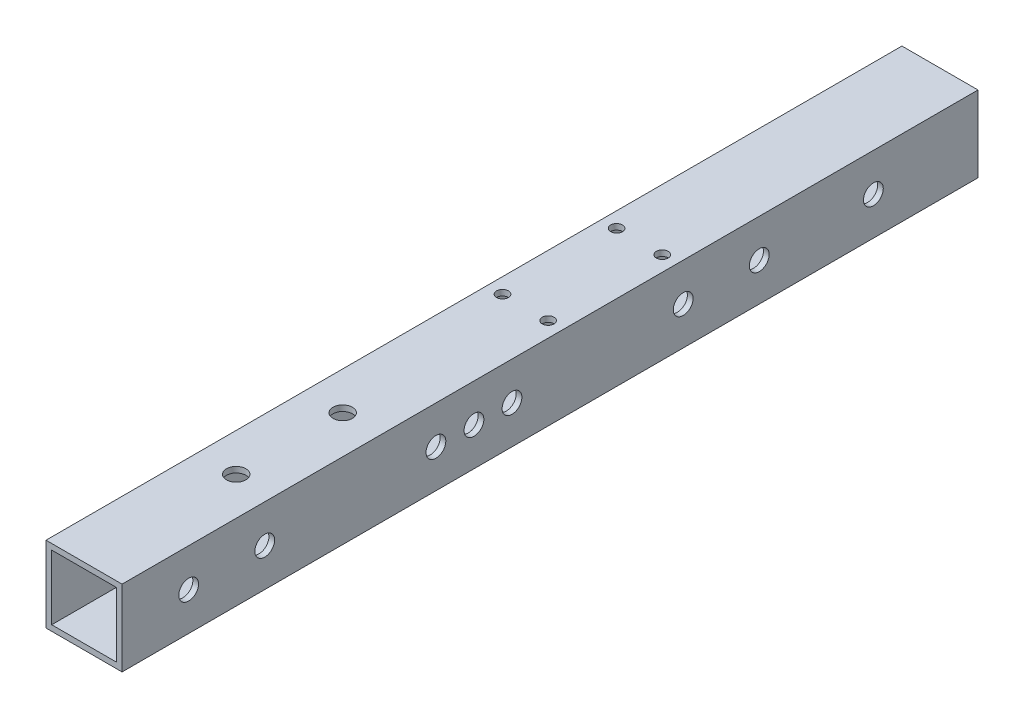
from build123d import *

# Parameters (mm, degrees)
SKETCH_1_W          = 20
SKETCH_1_H          = 20
SKETCH_1_W_2        = 17
SKETCH_1_H_2        = 17
EXTRUDE_1_DEPTH     = 112.5
SKETCH_2_R          = 2.55
CUT_EXTRUDE_1_DEPTH = 115.70069747
SKETCH_3_R          = 2.6
CUT_EXTRUDE_2_DEPTH = 115.70069747
SKETCH_4_R          = 1.55
CUT_EXTRUDE_3_DEPTH = 115.70069747


with BuildPart() as part:
    # 草图1 → 凸台-拉伸1 (new, symmetric)
    with BuildSketch(Plane.XY):
        Rectangle(SKETCH_1_W, SKETCH_1_H)
        Rectangle(SKETCH_1_W_2, SKETCH_1_H_2, mode=Mode.SUBTRACT)
    extrude(amount=EXTRUDE_1_DEPTH, both=True)

    # 草图2 → 切除-拉伸1 (cut, through all)
    with BuildSketch(Plane(origin=(0, 10, 0), x_dir=(1, 0, 0), z_dir=(0, 1, 0))):
        with Locations(Location((0, -72.5, 0), (0, 0, 270))):
            Circle(SKETCH_2_R)
        with Locations(Location((0, -44.5, 0), (0, 0, 270))):
            Circle(SKETCH_2_R)
    extrude(amount=-CUT_EXTRUDE_1_DEPTH, mode=Mode.SUBTRACT)

    # 草图3 → 切除-拉伸2 (cut, through all)
    with BuildSketch(Plane(origin=(10, 0, 0), x_dir=(0, 0, -1), z_dir=(1, 0, 0))):
        with Locations(Location((85, 0, 0), (0, 0, 90))):
            Circle(SKETCH_3_R)
        with Locations(Location((55, 0, 0), (0, 0, 90))):
            Circle(SKETCH_3_R)
        with Locations(Location((35, 0, 0), (0, 0, 90))):
            Circle(SKETCH_3_R)
        with Locations(Location((-10, 0, 0), (0, 0, 90))):
            Circle(SKETCH_3_R)
        with Locations(Location((-20, 0, 0), (0, 0, 90))):
            Circle(SKETCH_3_R)
        with Locations(Location((-30, 0, 0), (0, 0, 90))):
            Circle(SKETCH_3_R)
        with Locations(Location((-75, 0, 0), (0, 0, 90))):
            Circle(SKETCH_3_R)
        with Locations(Location((-95, 0, 0), (0, 0, 90))):
            Circle(SKETCH_3_R)
    extrude(amount=-CUT_EXTRUDE_2_DEPTH, mode=Mode.SUBTRACT)

    # 草图4 → 切除-拉伸3 (cut, through all)
    with BuildSketch(Plane(origin=(0, 10, 0), x_dir=(1, 0, 0), z_dir=(0, 1, 0))):
        with Locations(Location((-6, 3.5, 0), (0, 0, 270))):
            Circle(SKETCH_4_R)
        with Locations(Location((6, 3.5, 0), (0, 0, 270))):
            Circle(SKETCH_4_R)
        with Locations(Location((-6, 33.5, 0), (0, 0, 270))):
            Circle(SKETCH_4_R)
        with Locations(Location((6, 33.5, 0), (0, 0, 270))):
            Circle(SKETCH_4_R)
    extrude(amount=-CUT_EXTRUDE_3_DEPTH, mode=Mode.SUBTRACT)


solid = part.part
